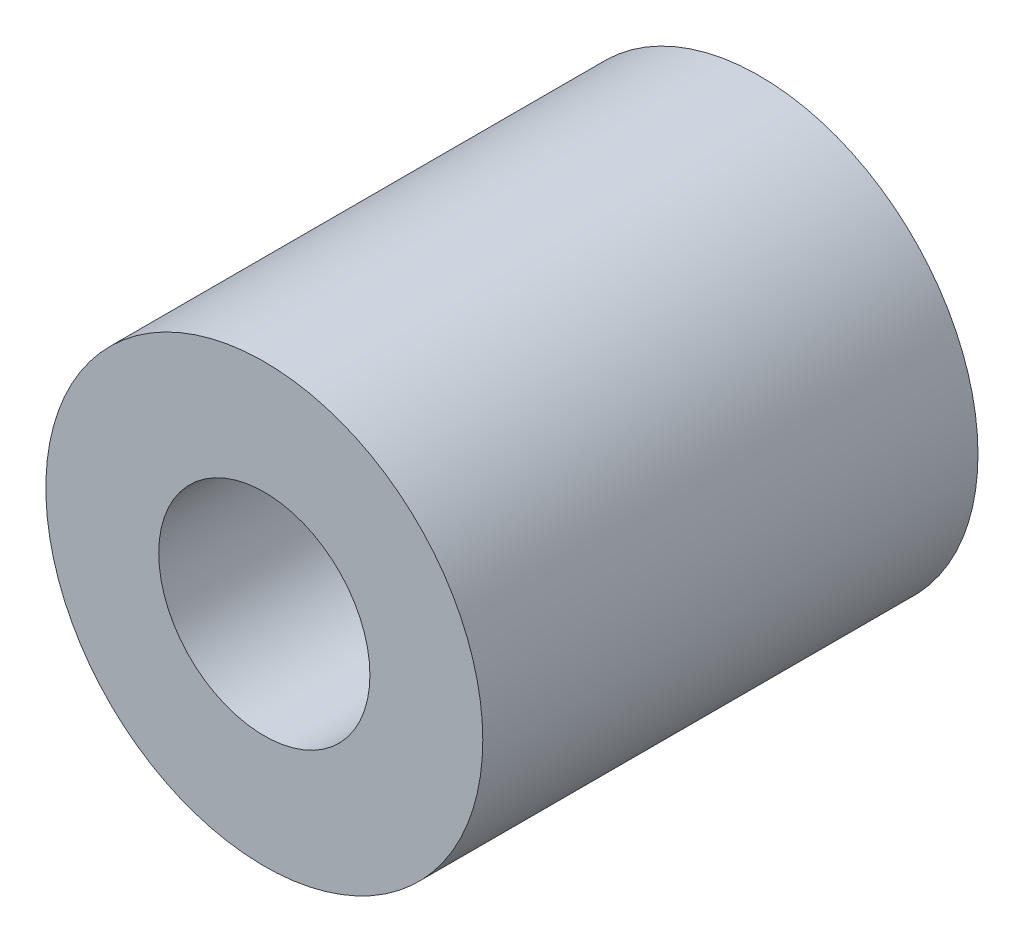
from build123d import *

# Parameters (mm, degrees)
SKETCH1_R           = 15
BOSS_EXTRUDE1_DEPTH = 34


with BuildPart() as part:
    # Sketch1 → Boss-Extrude1 (new body)
    with BuildSketch(Plane.XY):
        Circle(SKETCH1_R)
    extrude(amount=BOSS_EXTRUDE1_DEPTH)

    # Sketch2 → Cut-Revolve1 (revolve, cut)
    with BuildSketch(Plane(origin=(0, 0, 0), x_dir=(0, 0, -1), z_dir=(1, 0, 0)), mode=Mode.PRIVATE) as cut_revolve1_sk:
        Polygon((0, 0), (0, 3.175), (-17, 3.175), (-17, 7.25), (-34, 7.25), (-34, 0), align=None)
    revolve(cut_revolve1_sk.sketch.rotate(Axis((0, 0, 34), (0, 0, -1)), 90), axis=Axis((0, 0, 34), (0, 0, -1)), mode=Mode.SUBTRACT)


solid = part.part
